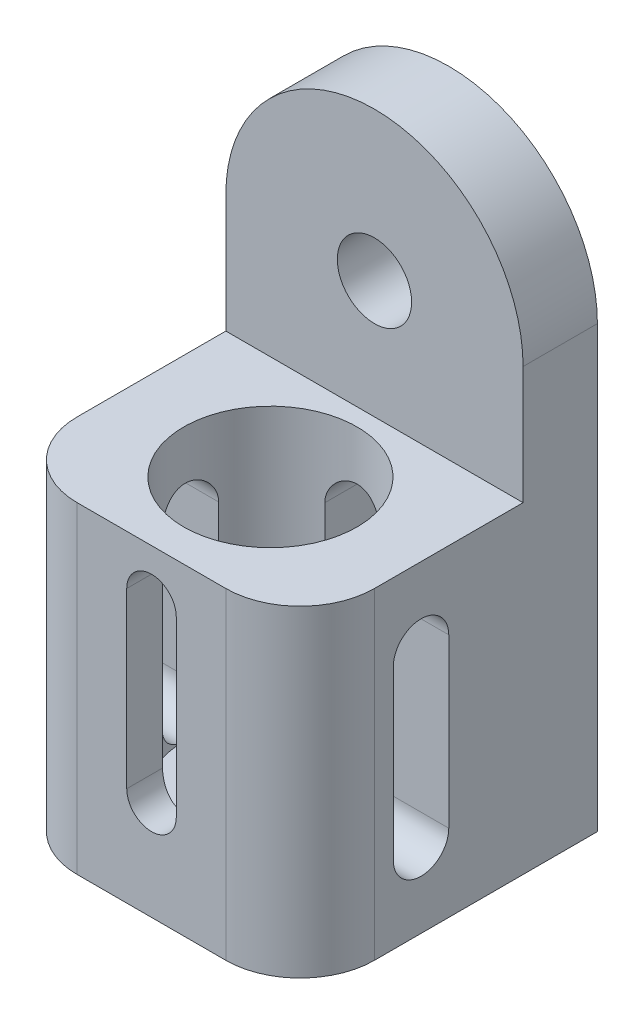
from build123d import *

# Parameters (mm, degrees)
SKETCH1_W                   = 76.2
SKETCH1_H                   = 76.2
BOSS_EXTRUDE1_DEPTH         = 82.55
SKETCH2_W                   = 76.2
SKETCH2_H                   = 19.05
BOSS_EXTRUDE2_DEPTH         = 30.226
BOSS_EXTRUDE3_DEPTH         = 19.05
FILLET1_R                   = 19.05
CUT_EXTRUDE1_DEPTH          = 119.627789746
SKETCH5_R                   = 22.225
CUT_EXTRUDE2_DEPTH          = 69.85
CUT_EXTRUDE3_DEPTH          = 119.627789778
CUT_EXTRUDE3_DEPTH_BACK     = 50.8
CUT_EXTRUDE4_DEPTH          = 25.4
F_3_8_0_75_DIAMETER_HOLE1_D = 19.05


with BuildPart() as part:
    # Sketch1 → Boss-Extrude1 (new body)
    with BuildSketch(Plane(origin=(0, 0, 0), x_dir=(1, 0, 0), z_dir=(0, 1, 0))):
        Rectangle(SKETCH1_W, SKETCH1_H)
    extrude(amount=-BOSS_EXTRUDE1_DEPTH)

    # Sketch2 → Boss-Extrude2 (add)
    with BuildSketch(Plane(origin=(0, 0, 0), x_dir=(1, 0, 0), z_dir=(0, 1, 0))):
        with Locations((0, 28.575)):
            Rectangle(SKETCH2_W, SKETCH2_H)
    extrude(amount=BOSS_EXTRUDE2_DEPTH)

    # Sketch3 → Boss-Extrude3 (add)
    with BuildSketch(Plane(origin=(0, 0, -38.1), x_dir=(-1, 0, 0), z_dir=(0, 0, -1))):
        with BuildLine():
            Line((-38.1, 30.226), (38.1, 30.226))
            ThreePointArc((38.1, 30.226), (0, 68.326), (-38.1, 30.226))
        make_face()
    extrude(amount=-BOSS_EXTRUDE3_DEPTH)

    # Fillet1
    fillet1_edges = [part.edges().sort_by_distance(p)[0] for p in [
        (38.1, -41.275, 38.1),
        (-38.1, -41.275, 38.1),
    ]]
    fillet(fillet1_edges, radius=FILLET1_R)

    # Sketch4 → Cut-Extrude1 (cut, through all)
    with BuildSketch(Plane(origin=(38.1, 0, 0), x_dir=(0, 0, -1), z_dir=(1, 0, 0))):
        with BuildLine():
            Line((0, -19.812), (0, -62.738))
            ThreePointArc((0, -62.738), (-7.112, -69.85), (-14.224, -62.738))
            Line((-14.224, -62.738), (-14.224, -19.812))
            ThreePointArc((-14.224, -19.812), (-7.112, -12.7), (0, -19.812))
        make_face()
    extrude(amount=-CUT_EXTRUDE1_DEPTH, mode=Mode.SUBTRACT)

    # Sketch5 → Cut-Extrude2 (cut)
    with BuildSketch(Plane(origin=(0, 0, 0), x_dir=(1, 0, 0), z_dir=(0, 1, 0))):
        with Locations(Location((0, -7.62, 0), (0, 0, 270))):
            Circle(SKETCH5_R)
    extrude(amount=-CUT_EXTRUDE2_DEPTH, mode=Mode.SUBTRACT)

    # Sketch6 → Cut-Extrude3 (cut, two sides: drawn at the far end of the back side and taken through both)
    with BuildSketch(Plane(origin=(0, 0, -38.1), x_dir=(-1, 0, 0), z_dir=(0, 0, -1)).offset(-CUT_EXTRUDE3_DEPTH_BACK)):
        with BuildLine():
            Line((7.112, -19.812), (7.112, -62.738))
            ThreePointArc((7.112, -62.738), (0, -69.85), (-7.112, -62.738))
            Line((-7.112, -62.738), (-7.112, -19.812))
            ThreePointArc((-7.112, -19.812), (0, -12.7), (7.112, -19.812))
        make_face()
    extrude(amount=CUT_EXTRUDE3_DEPTH + CUT_EXTRUDE3_DEPTH_BACK, mode=Mode.SUBTRACT)

    # Sketch7 → Cut-Extrude4 (cut)
    with BuildSketch(Plane.XY.offset(38.1)):
        with BuildLine():
            Line((6.35, -12.7), (6.35, -57.15))
            ThreePointArc((6.35, -57.15), (0, -63.5), (-6.35, -57.15))
            Line((-6.35, -57.15), (-6.35, -12.7))
            ThreePointArc((-6.35, -12.7), (0, -6.35), (6.35, -12.7))
        make_face()
    extrude(amount=-CUT_EXTRUDE4_DEPTH, mode=Mode.SUBTRACT)

    # 3/8 (0.75) Diameter Hole1 (through all)
    with Locations(Plane.XY.offset(-19.05)):
        with Locations((0, 30.226)):
            Hole(F_3_8_0_75_DIAMETER_HOLE1_D / 2)


solid = part.part
